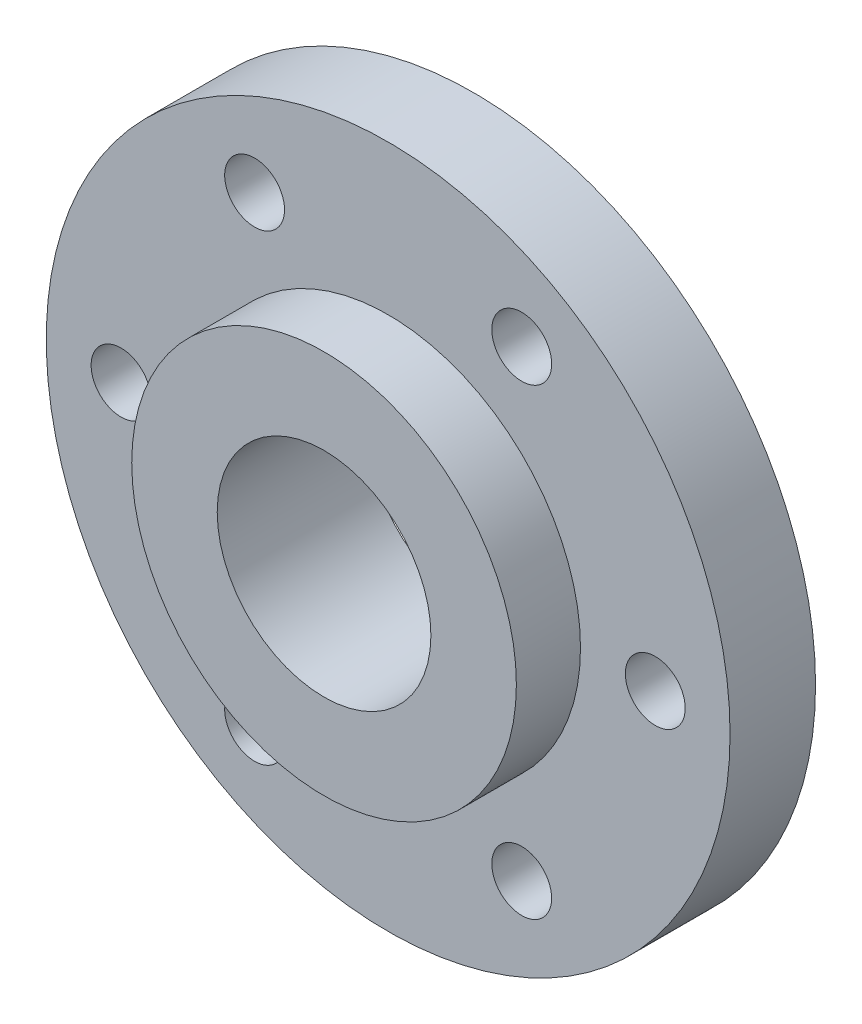
from build123d import *

# Parameters (mm, degrees)
SKETCH_1_R               = 80
SKETCH_1_R_2             = 25
EXTRUDE_1_DEPTH          = 20
EXTRUDE_START            = 15
SKETCH_2_R               = 45
SKETCH_2_R_2             = 25
EXTRUDE_2_DEPTH          = 15
CUT_EXTRUDE_1_DEPTH      = 115.891252931
CUT_EXTRUDE_1_DEPTH_BACK = 115.891252931
SKETCH_3_R               = 7


with BuildPart() as part:
    # 草图1 → 凸台-拉伸1 (new body)
    with BuildSketch(Plane.XY):
        Circle(SKETCH_1_R)
        Circle(SKETCH_1_R_2, mode=Mode.SUBTRACT)
    extrude(amount=-EXTRUDE_1_DEPTH)

    # 草图2 → 凸台-拉伸2 (add)
    with BuildSketch(Plane.XY.offset(EXTRUDE_START)):
        Circle(SKETCH_2_R)
        Circle(SKETCH_2_R_2, mode=Mode.SUBTRACT)
    extrude(amount=-EXTRUDE_2_DEPTH)

    # 草图3 → 切除-拉伸1 (cut, two sides: drawn at the far end of the back side and taken through both)
    with BuildSketch(Plane.XY.offset(-CUT_EXTRUDE_1_DEPTH_BACK)):
        with Locations((62.5, 0)):
            Circle(SKETCH_3_R)
        with Locations((31.25, 54.126587737)):
            Circle(SKETCH_3_R)
        with Locations((-31.25, 54.126587737)):
            Circle(SKETCH_3_R)
        with Locations((-62.5, 0)):
            Circle(SKETCH_3_R)
        with Locations((-31.25, -54.126587737)):
            Circle(SKETCH_3_R)
        with Locations((31.25, -54.126587737)):
            Circle(SKETCH_3_R)
    extrude(amount=CUT_EXTRUDE_1_DEPTH + CUT_EXTRUDE_1_DEPTH_BACK, mode=Mode.SUBTRACT)


solid = part.part
